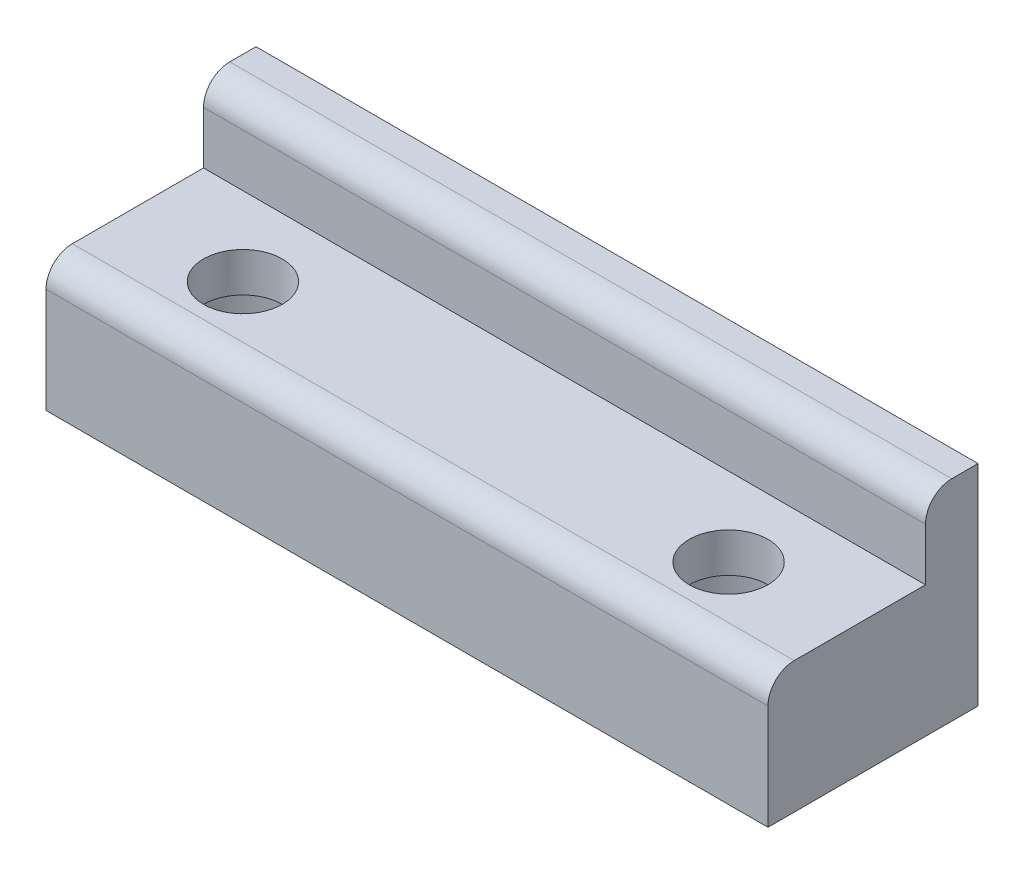
from build123d import *

# Parameters (mm, degrees)
SKETCH_1_W          = 27.5
SKETCH_1_H          = 8
EXTRUDE_1_DEPTH     = 5
SKETCH_2_W          = 27.5
SKETCH_2_H          = 2
EXTRUDE_2_DEPTH     = 3
SKETCH_3_R          = 1.5
CUT_EXTRUDE_1_DEPTH = 30.07318352
SKETCH_4_R          = 2.95
CUT_EXTRUDE_6_DEPTH = 3.5
FILLET_1_R          = 1
FILLET_2_R          = 1


with BuildPart() as part:
    # Эскиз1 → Бобышка-Вытянуть1 (new body)
    with BuildSketch(Plane(origin=(0, 0, 0), x_dir=(1, 0, 0), z_dir=(0, 1, 0))):
        with Locations((13.75, 4)):
            Rectangle(SKETCH_1_W, SKETCH_1_H)
    extrude(amount=EXTRUDE_1_DEPTH)

    # Эскиз2 → Бобышка-Вытянуть2 (add)
    with BuildSketch(Plane(origin=(0, 5, 0), x_dir=(1, 0, 0), z_dir=(0, 1, 0))):
        with Locations((13.75, 7)):
            Rectangle(SKETCH_2_W, SKETCH_2_H)
    extrude(amount=EXTRUDE_2_DEPTH)

    # Эскиз3 → Вырез-Вытянуть1 (cut, through all)
    with BuildSketch(Plane(origin=(0, 5, 0), x_dir=(1, 0, 0), z_dir=(0, 1, 0))):
        with Locations(Location((4.5, 3, 0), (0, 0, 270))):
            Circle(SKETCH_3_R)
        with Locations(Location((23, 3, 0), (0, 0, 270))):
            Circle(SKETCH_3_R)
    extrude(amount=-CUT_EXTRUDE_1_DEPTH, mode=Mode.SUBTRACT)

    # Эскиз4 → Вырез-Вытянуть6 (cut)
    with BuildSketch(Plane(origin=(0, 0, 0), x_dir=(-1, 0, 0), z_dir=(0, -1, 0))):
        with Locations(Location((-4.5, 3, 0), (0, 0, 90))):
            Circle(SKETCH_4_R)
        with Locations(Location((-23, 3, 0), (0, 0, 90))):
            Circle(SKETCH_4_R)
    extrude(amount=-CUT_EXTRUDE_6_DEPTH, mode=Mode.SUBTRACT)

    # Скругление1
    fillet_1_edges = [part.edges().sort_by_distance(p)[0] for p in [
        (13.75, 8, -6),
    ]]
    fillet(fillet_1_edges, radius=FILLET_1_R)

    # Скругление2
    fillet_2_edges = [part.edges().sort_by_distance(p)[0] for p in [
        (13.75, 5, 0),
    ]]
    fillet(fillet_2_edges, radius=FILLET_2_R)


solid = part.part
